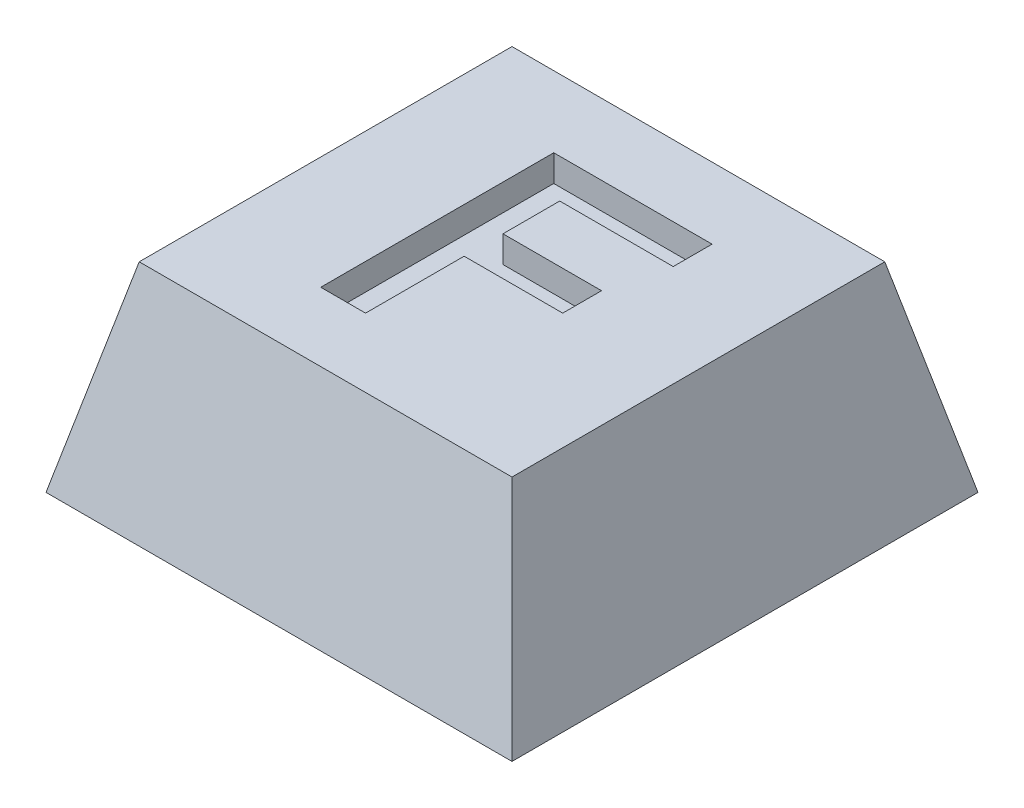
from build123d import *

# Parameters (mm, degrees)
SKETCH1_W           = 7
SKETCH1_H           = 7
BOSS_EXTRUDE1_DEPTH = 3
CUT_EXTRUDE1_DEPTH  = 7
CUT_EXTRUDE2_DEPTH  = 11
SKETCH4_R           = 1.8
CUT_EXTRUDE3_DEPTH  = 0.8
CUT_EXTRUDE4_DEPTH  = 0.4


with BuildPart() as part:
    # Sketch1 → Boss-Extrude1 (new body)
    with BuildSketch(Plane(origin=(0, 0, 0), x_dir=(1, 0, 0), z_dir=(0, 1, 0))):
        with Locations((3.5, 3.5)):
            Rectangle(SKETCH1_W, SKETCH1_H)
    extrude(amount=BOSS_EXTRUDE1_DEPTH)

    # Sketch2 → Cut-Extrude1 (cut)
    with BuildSketch(Plane.XY):
        Polygon((0, 0), (0.7, 3), (0, 3), align=None)
        Polygon((7, 0), (6.3, 3), (7, 3), align=None)
    extrude(amount=-CUT_EXTRUDE1_DEPTH, mode=Mode.SUBTRACT)

    # Sketch3 → Cut-Extrude2 (cut)
    with BuildSketch(Plane(origin=(0, 0, 0), x_dir=(0, 0, -1), z_dir=(1, 0, 0))):
        Polygon((0, 0), (0.7, 3), (0, 3), align=None)
        Polygon((7, 3), (6.3, 3), (7, 0), align=None)
    extrude(amount=CUT_EXTRUDE2_DEPTH, mode=Mode.SUBTRACT)

    # Sketch4 → Cut-Extrude3 (cut)
    with BuildSketch(Plane.XZ):
        with Locations(Location((3.5, -3.5, 0), (0, 0, 270))):
            Circle(SKETCH4_R)
    extrude(amount=-CUT_EXTRUDE3_DEPTH, mode=Mode.SUBTRACT)

    # Sketch5 → Cut-Extrude4 (cut)
    with BuildSketch(Plane(origin=(0, 3, 0), x_dir=(1, 0, 0), z_dir=(0, 1, 0))):
        Polygon((2.394882383, 1.732294481), (2.394882383, 5.232294481), (4.773087512, 5.232294481), (4.773087512, 4.648961148), (3.067959306, 4.648961148), (3.067959306, 3.796397045), (4.548728537, 3.796397045), (4.548728537, 3.213063712), (3.067959306, 3.213063712), (3.067959306, 1.732294481), align=None)
    extrude(amount=-CUT_EXTRUDE4_DEPTH, mode=Mode.SUBTRACT)


solid = part.part
